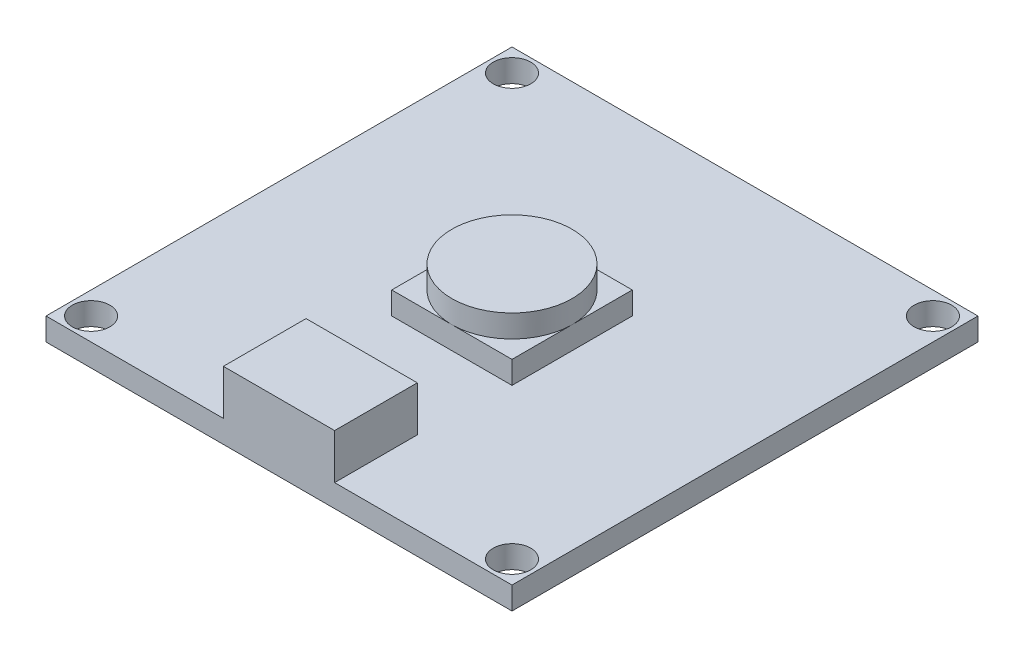
from build123d import *

# Parameters (mm, degrees)
SKETCH1_W           = 31
SKETCH1_H           = 31
BOSS_EXTRUDE1_DEPTH = 1.5
SKETCH2_W           = 8
SKETCH2_H           = 8
BOSS_EXTRUDE2_DEPTH = 1.5
SKETCH3_R           = 4
BOSS_EXTRUDE3_DEPTH = 1.5
SKETCH4_W           = 7.4
SKETCH4_H           = 5.5
BOSS_EXTRUDE4_DEPTH = 3
SKETCH5_R           = 1.25
CUT_EXTRUDE1_DEPTH  = 23.12464689


with BuildPart() as part:
    # Sketch1 → Boss-Extrude1 (new body)
    with BuildSketch(Plane(origin=(0, 0, 0), x_dir=(1, 0, 0), z_dir=(0, 1, 0))):
        Rectangle(SKETCH1_W, SKETCH1_H)
    extrude(amount=BOSS_EXTRUDE1_DEPTH)

    # Sketch2 → Boss-Extrude2 (add)
    with BuildSketch(Plane(origin=(0, 1.5, 0), x_dir=(1, 0, 0), z_dir=(0, 1, 0))):
        Rectangle(SKETCH2_W, SKETCH2_H)
    extrude(amount=BOSS_EXTRUDE2_DEPTH)

    # Sketch3 → Boss-Extrude3 (add)
    with BuildSketch(Plane(origin=(0, 3, 0), x_dir=(1, 0, 0), z_dir=(0, 1, 0))):
        with Locations(Location((0, 0, 0), (0, 0, 270))):
            Circle(SKETCH3_R)
    extrude(amount=BOSS_EXTRUDE3_DEPTH)

    # Sketch4 → Boss-Extrude4 (add)
    with BuildSketch(Plane(origin=(0, 1.5, 0), x_dir=(1, 0, 0), z_dir=(0, 1, 0))):
        with Locations((0, -12.75)):
            Rectangle(SKETCH4_W, SKETCH4_H)
    extrude(amount=BOSS_EXTRUDE4_DEPTH)

    # Sketch5 → Cut-Extrude1 (cut, through all)
    with BuildSketch(Plane(origin=(0, 1.5, 0), x_dir=(1, 0, 0), z_dir=(0, 1, 0))):
        with Locations(Location((-14, 14, 0), (0, 0, 270))):
            Circle(SKETCH5_R)
        with Locations(Location((14, 14, 0), (0, 0, 270))):
            Circle(SKETCH5_R)
        with Locations(Location((14, -14, 0), (0, 0, 270))):
            Circle(SKETCH5_R)
        with Locations(Location((-14, -14, 0), (0, 0, 270))):
            Circle(SKETCH5_R)
    extrude(amount=-CUT_EXTRUDE1_DEPTH, mode=Mode.SUBTRACT)


solid = part.part
